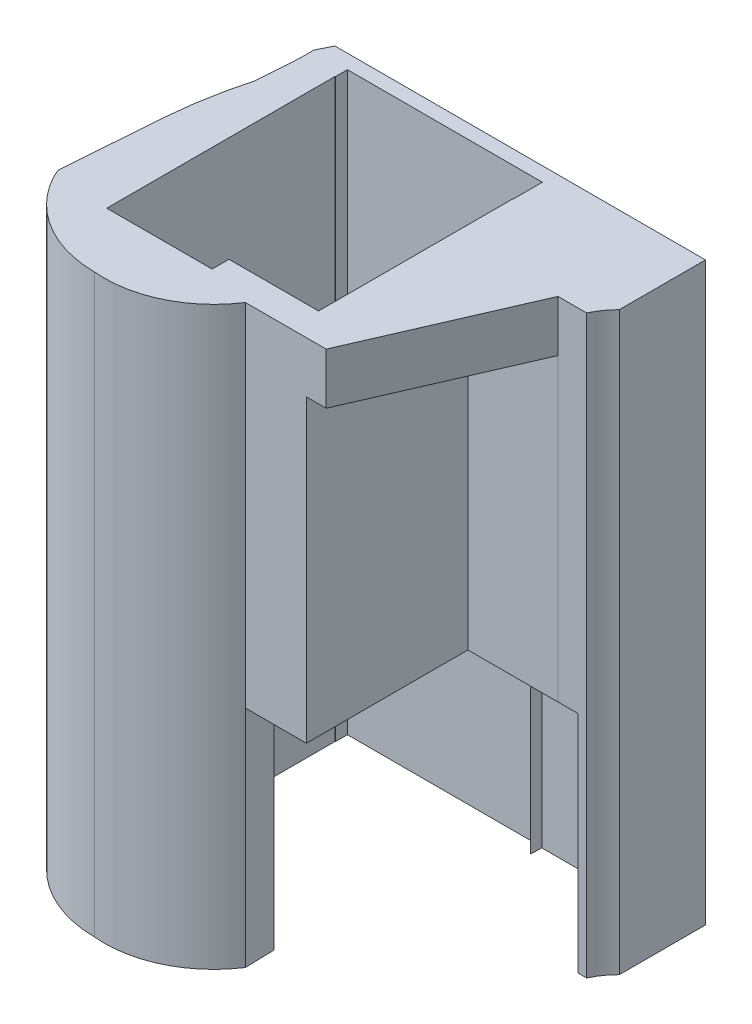
from build123d import *

# Parameters (mm, degrees)
BOSS_EXTRUDE1_DEPTH = 82
CUT_EXTRUDE1_DEPTH  = 105
SKETCH3_W           = 23
SKETCH3_H           = 43
CUT_EXTRUDE2_DEPTH  = 28
CUT_EXTRUDE3_DEPTH  = 32
CUT_EXTRUDE4_DEPTH  = 32
SKETCH7_W           = 12.805148614
SKETCH7_H           = 2.400001526
CUT_EXTRUDE5_DEPTH  = 89
SKETCH8_W           = 27.756866021
SKETCH8_H           = 1.710281704
CUT_EXTRUDE6_DEPTH  = 89


with BuildPart() as part:
    # Sketch1 → Boss-Extrude1 (new body)
    with BuildSketch(Plane(origin=(0, 0, 0), x_dir=(1, 0, 0), z_dir=(0, 1, 0))):
        with BuildLine():
            Line((-21.9286378, 20.529965557), (30.819410356, 20.529965557))
            Line((30.819410356, 20.529965557), (30.819410356, 8.269460429))
            ThreePointArc((30.819410356, 8.269460429), (29.737157279, 6.984989328), (28.898083391, 5.52996605))
            Line((28.898083391, 5.52996605), (24.81959218, 5.52996605))
            Line((24.81959218, 5.52996605), (14.820019426, -17.47003395))
            Line((14.820019426, -17.47003395), (3.320446672, -17.47003395))
            ThreePointArc((3.320446672, -17.47003395), (-2.977277813, -22.983126936), (-11.218310652, -24.446310348))
            ThreePointArc((-11.218310652, -24.446310348), (-19.829053504, -21.990642561), (-25.924914656, -15.432009048))
            Line((-25.924914656, -15.432009048), (-26.328479109, -14.47003395))
            Line((-26.328479109, -14.47003395), (-25.288623152, -0.544399566))
            Line((-25.288623152, -0.544399566), (-24.844287214, 3.45451706))
            Line((-24.844287214, 3.45451706), (-24.102893172, 7.451406174))
            Line((-24.102893172, 7.451406174), (-23.328601179, 10.529965096))
            Line((-23.328601179, 10.529965096), (-22.928576765, 16.529967242))
            Line((-22.928576765, 16.529967242), (-22.928576765, 18.529964858))
            Line((-22.928576765, 18.529964858), (-21.9286378, 20.529965557))
        make_face()
    extrude(amount=BOSS_EXTRUDE1_DEPTH)

    # Sketch2 → Cut-Extrude1 (cut)
    with BuildSketch(Plane.XZ):
        Polygon((-18.173439963, -16.784486826), (-18.173439963, 15.715513413), (-3.173989279, 15.715513413), (-3.173989279, 13.315508549), (9.57552244, 13.315508549), (9.57552244, -14.3844853), (-3.173989279, -14.3844853), (-3.173989279, -16.784486826), align=None)
    extrude(amount=-CUT_EXTRUDE1_DEPTH, mode=Mode.SUBTRACT)

    # Sketch3 → Cut-Extrude2 (cut)
    with BuildSketch(Plane(origin=(40, 0, 0), x_dir=(0, 0, -1), z_dir=(1, 0, 0))):
        with Locations((-5.976477548, 53.208460465)):
            Rectangle(SKETCH3_W, SKETCH3_H)
    extrude(amount=-CUT_EXTRUDE2_DEPTH, mode=Mode.SUBTRACT)

    # Sketch5 → Cut-Extrude3 (cut)
    with BuildSketch(Plane.XZ):
        Polygon((14.820019426, 17.47003395), (24.81959218, -5.52996605), (14.820019426, -5.52996605), align=None)
    extrude(amount=-CUT_EXTRUDE3_DEPTH, mode=Mode.SUBTRACT)

    # Sketch6 → Cut-Extrude4 (cut)
    with BuildSketch(Plane.XZ):
        Polygon((27.668053931, -5.521484947), (27.668053931, -9.376004197), (27.668053931, -18.376004197), (9.668053931, -18.376004197), (9.57552244, -14.3844853), (9.57552244, 13.315508549), (3.20076658, 13.315508549), (3.320446672, 17.47003395), (14.820019426, 17.47003395), (14.820019426, -5.52996605), align=None)
    extrude(amount=-CUT_EXTRUDE4_DEPTH, mode=Mode.SUBTRACT)

    # Sketch7 → Cut-Extrude5 (cut)
    with BuildSketch(Plane.XZ):
        with Locations((3.228585028, -15.584486063)):
            Rectangle(SKETCH7_W, SKETCH7_H)
    extrude(amount=-CUT_EXTRUDE5_DEPTH, mode=Mode.SUBTRACT)

    # Sketch8 → Cut-Extrude6 (cut)
    with BuildSketch(Plane.XZ):
        with Locations((-4.247273675, -17.639627678)):
            Rectangle(SKETCH8_W, SKETCH8_H)
    extrude(amount=-CUT_EXTRUDE6_DEPTH, mode=Mode.SUBTRACT)


solid = part.part
